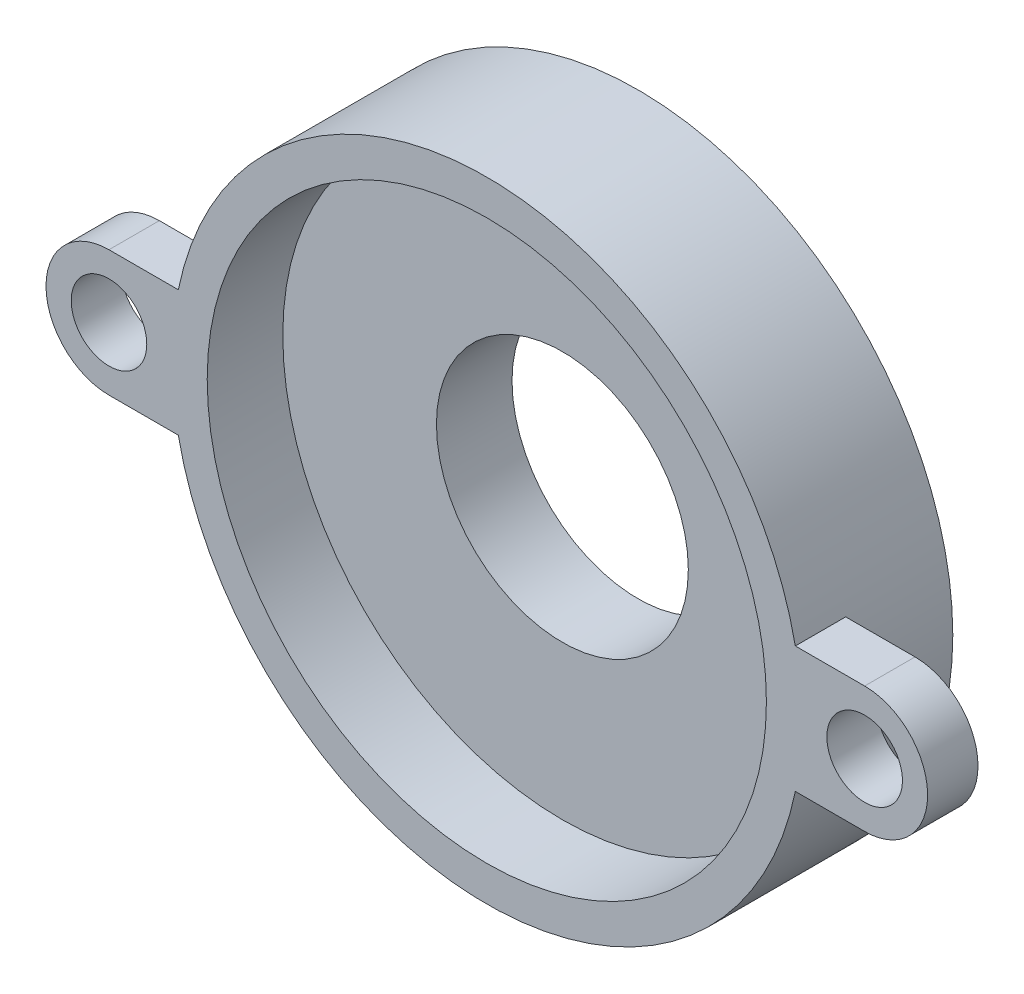
from build123d import *

# Parameters (mm, degrees)
SKETCH2_R           = 12.5
SKETCH2_R_2         = 5
BOSS_EXTRUDE3_DEPTH = 6
SKETCH4_R           = 11.1
CUT_EXTRUDE1_DEPTH  = 3
BOSS_EXTRUDE4_START = -2
SKETCH5_R           = 1.5
BOSS_EXTRUDE4_DEPTH = 2


with BuildPart() as part:
    # Sketch2 → Boss-Extrude3 (new body)
    with BuildSketch(Plane.XY):
        Circle(SKETCH2_R)
        Circle(SKETCH2_R_2, mode=Mode.SUBTRACT)
    extrude(amount=BOSS_EXTRUDE3_DEPTH)

    # Sketch4 → Cut-Extrude1 (cut)
    with BuildSketch(Plane.XY.offset(6)):
        Circle(SKETCH4_R)
    extrude(amount=-CUT_EXTRUDE1_DEPTH, mode=Mode.SUBTRACT)

    # Sketch5 → Boss-Extrude4 (add)
    # profile 1 of 2: a face of its own
    with BuildSketch(Plane.XY.offset(6).offset(BOSS_EXTRUDE4_START)):
        with BuildLine():
            Line((-15, 2.5), (-12.247448714, 2.5))
            ThreePointArc((-12.247448714, 2.5), (-12.5, 0), (-12.247448714, -2.5))
            Line((-12.247448714, -2.5), (-15, -2.5))
            ThreePointArc((-15, -2.5), (-17.5, 0), (-15, 2.5))
        make_face()
        with Locations((-15, 0)):
            Circle(SKETCH5_R, mode=Mode.SUBTRACT)
    # profile 2 of 2: a face of its own
    with BuildSketch(Plane.XY.offset(6).offset(BOSS_EXTRUDE4_START)):
        with BuildLine():
            Line((15, -2.5), (12.247448714, -2.5))
            ThreePointArc((12.247448714, -2.5), (12.5, 0), (12.247448714, 2.5))
            Line((12.247448714, 2.5), (15, 2.5))
            ThreePointArc((15, 2.5), (17.5, 0), (15, -2.5))
        make_face()
        with Locations(Location((15, 0, 0), (0, 0, 180))):
            Circle(SKETCH5_R, mode=Mode.SUBTRACT)
    extrude(amount=BOSS_EXTRUDE4_DEPTH)


solid = part.part
